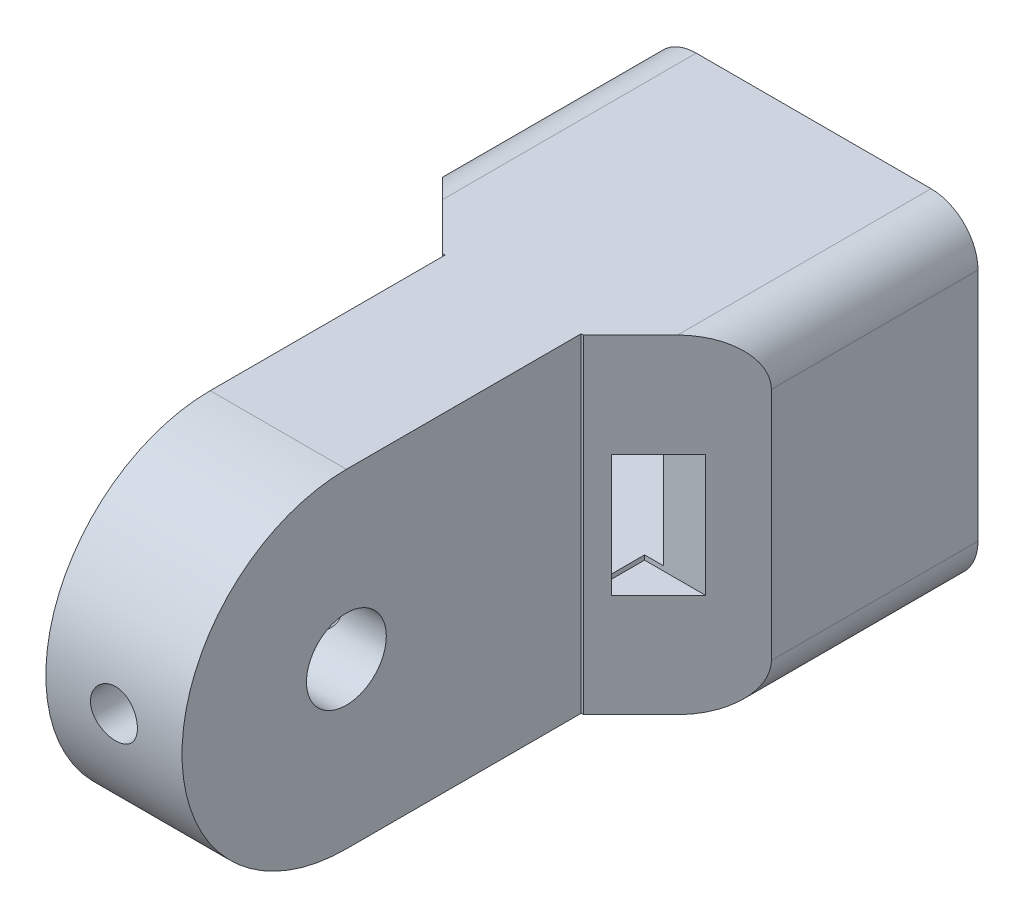
from build123d import *

# Parameters (mm, degrees)
CROQUIS6_R              = 4.25
SALIENTE_EXTRUIR2_DEPTH = 7.25
CROQUIS7_W              = 35
CROQUIS7_H              = 35
SALIENTE_EXTRUIR3_DEPTH = 32
CHAFL_N1_SIZE           = 10
CROQUIS8_W              = 14.5
CROQUIS8_H              = 12.03
CORTAR_EXTRUIR4_DEPTH   = 30.5
CROQUIS9_W              = 5
CROQUIS9_H              = 13
CORTAR_EXTRUIR5_DEPTH   = 10
REDONDEO1_R             = 5
CROQUIS10_R             = 1.5
CORTAR_EXTRUIR6_DEPTH   = 10
CROQUIS11_R             = 2.5
CORTAR_EXTRUIR7_DEPTH   = 30


with BuildPart() as part:
    # Croquis6 → Saliente-Extruir2 (new, symmetric)
    with BuildSketch(Plane(origin=(0, 0, 0), x_dir=(0, 0, -1), z_dir=(1, 0, 0))):
        with BuildLine():
            Line((0, 17.5), (25, 17.5))
            Line((25, 17.5), (25, -17.5))
            Line((25, -17.5), (0, -17.5))
            ThreePointArc((0, -17.5), (-17.5, 0), (0, 17.5))
        make_face()
        with Locations(Location((0, 0, 0), (0, 0, 180))):
            Circle(CROQUIS6_R, mode=Mode.SUBTRACT)
    extrude(amount=SALIENTE_EXTRUIR2_DEPTH, both=True)

    # Croquis7 → Saliente-Extruir3 (add)
    with BuildSketch(Plane(origin=(0, 0, -25), x_dir=(-1, 0, 0), z_dir=(0, 0, -1))):
        Rectangle(CROQUIS7_W, CROQUIS7_H)
    extrude(amount=SALIENTE_EXTRUIR3_DEPTH)

    # Chaflán1
    chafl_n1_edges = [part.edges().sort_by_distance(p)[0] for p in [
        (-17.5, 0, -25),
        (17.5, 0, -25),
    ]]
    chamfer(chafl_n1_edges, length=CHAFL_N1_SIZE)

    # Croquis8 → Cortar-Extruir4 (cut)
    with BuildSketch(Plane(origin=(0, 0, -57), x_dir=(-1, 0, 0), z_dir=(0, 0, -1))):
        with Locations((-2.25, 0)):
            Rectangle(CROQUIS8_W, CROQUIS8_H)
    extrude(amount=-CORTAR_EXTRUIR4_DEPTH, mode=Mode.SUBTRACT)

    # Croquis9 → Cortar-Extruir5 (cut)
    with BuildSketch(Plane(origin=(17.5, 0, 0), x_dir=(0, 0, -1), z_dir=(1, 0, 0))):
        with Locations((29, 0)):
            Rectangle(CROQUIS9_W, CROQUIS9_H)
    extrude(amount=-CORTAR_EXTRUIR5_DEPTH, mode=Mode.SUBTRACT)

    # Redondeo1
    redondeo1_edges = [part.edges().sort_by_distance(p)[0] for p in [
        (-17.5, -17.5, -46),
        (-17.5, 17.5, -46),
        (17.5, 17.5, -46),
        (17.5, -17.5, -46),
    ]]
    fillet(redondeo1_edges, radius=REDONDEO1_R)

    # Croquis10 → Cortar-Extruir6 (cut)
    with BuildSketch(Plane(origin=(0, 0, -57), x_dir=(-1, 0, 0), z_dir=(0, 0, -1))):
        with Locations((-12.5, 12.5)):
            Circle(CROQUIS10_R)
        with Locations((12.5, 12.5)):
            Circle(CROQUIS10_R)
        with Locations((12.5, -12.5)):
            Circle(CROQUIS10_R)
        with Locations((-12.5, -12.5)):
            Circle(CROQUIS10_R)
    extrude(amount=-CORTAR_EXTRUIR6_DEPTH, mode=Mode.SUBTRACT)

    # Croquis11 → Cortar-Extruir7 (cut)
    with BuildSketch(Plane.XY.offset(20)):
        Circle(CROQUIS11_R)
    extrude(amount=-CORTAR_EXTRUIR7_DEPTH, mode=Mode.SUBTRACT)


solid = part.part
